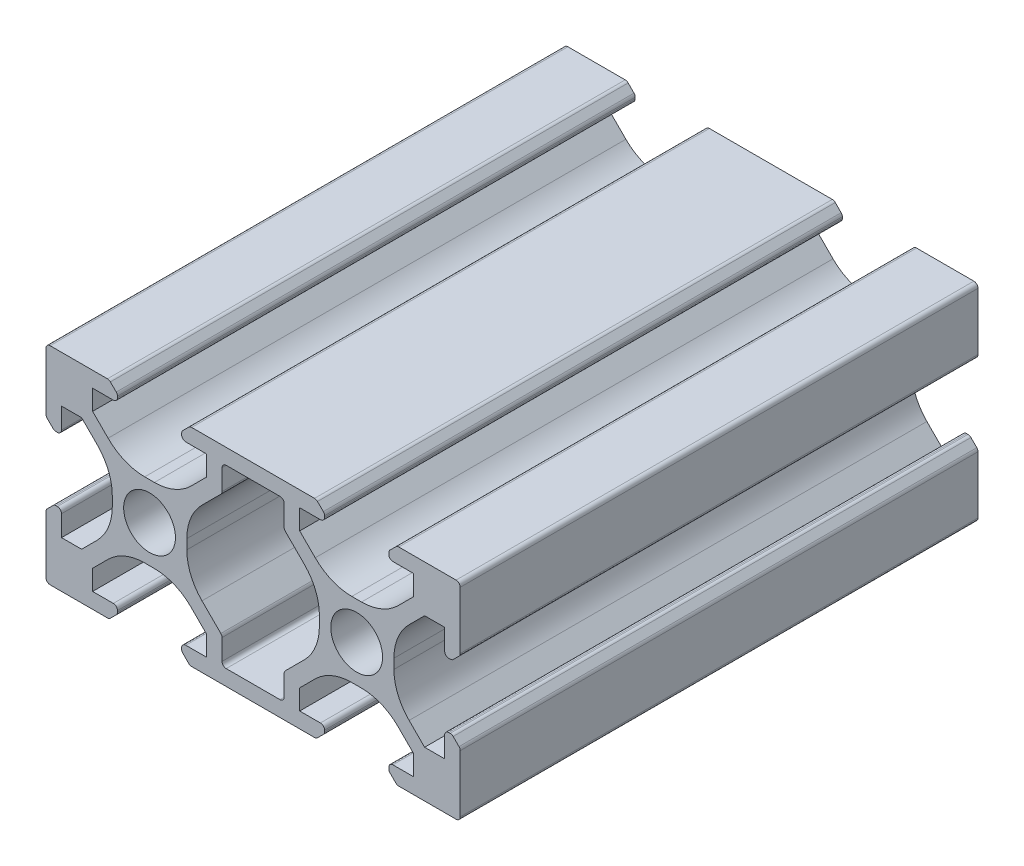
from build123d import *

# Parameters (mm, degrees)
RESSALTO_EXTRUS_O1_DEPTH    = 50
PADR_OCIRCULAR1_COUNT       = 4
PADR_O_LINEAR1_COUNT        = 2
PADR_O_LINEAR1_PITCH        = 20
PADR_O_LINEAR1_COPY_1_DEPTH = 50
PADR_O_LINEAR1_COPY_2_DEPTH = 50
PADR_O_LINEAR1_COPY_3_DEPTH = 50
CORTE_EXTRUS_O1_DEPTH       = 60.160797831
FILETE1_R                   = 0.4
FILETE2_R                   = 0.4


with BuildPart() as part:
    # Esboço1 → Ressalto-extrusão1 (new body)
    with BuildSketch(Plane.XY):
        with BuildLine():
            ThreePointArc((-9.317157288, 3.217157288), (-9.187387948, 3.130448187), (-9.034314575, 3.1))
            Line((-9.034314575, 3.1), (-8.9, 3.1))
            ThreePointArc((-8.9, 3.1), (-8.617157288, 3.217157288), (-8.5, 3.5))
            Line((-8.5, 3.5), (-8.5, 5.5))
            Line((-8.5, 5.5), (-6.560660172, 5.5))
            Line((-6.560660172, 5.5), (-5.064466094, 4.003805922))
            ThreePointArc((-5.064466094, 4.003805922), (-3.980602337, 2.381689178), (-3.6, 0.468272016))
            Line((-3.6, 0.468272016), (-3.6, 0))
            Line((-3.6, 0), (-2.5, 0))
            ThreePointArc((-2.5, 0), (-1.767766953, 1.767766953), (0, 2.5))
            Line((0, 2.5), (0, 3.6))
            Line((0, 3.6), (-0.468272016, 3.6))
            ThreePointArc((-0.468272016, 3.6), (-2.381689178, 3.980602337), (-4.003805922, 5.064466094))
            Line((-4.003805922, 5.064466094), (-5.5, 6.560660172))
            Line((-5.5, 6.560660172), (-5.5, 8.5))
            Line((-5.5, 8.5), (-3.5, 8.5))
            ThreePointArc((-3.5, 8.5), (-3.217157288, 8.617157288), (-3.1, 8.9))
            Line((-3.1, 8.9), (-3.1, 9.034314575))
            ThreePointArc((-3.1, 9.034314575), (-3.130448187, 9.187387948), (-3.217157288, 9.317157288))
            Line((-3.217157288, 9.317157288), (-3.782842712, 9.882842712))
            ThreePointArc((-3.782842712, 9.882842712), (-3.912612052, 9.969551813), (-4.065685425, 10))
            Line((-4.065685425, 10), (-10, 10))
            Line((-10, 10), (-10, 4.065685425))
            ThreePointArc((-10, 4.065685425), (-9.969551813, 3.912612052), (-9.882842712, 3.782842712))
            Line((-9.882842712, 3.782842712), (-9.317157288, 3.217157288))
        make_face()
    ressalto_extrus_o1 = extrude(amount=RESSALTO_EXTRUS_O1_DEPTH)

    # PadrãoCircular1: Ressalto-extrusão1 ×4 about axis
    padr_ocircular1_axis = Axis((0, 0, 0), (0, 0, 1))
    for i in range(1, PADR_OCIRCULAR1_COUNT):
        add(ressalto_extrus_o1.rotate(padr_ocircular1_axis, i * 360 / PADR_OCIRCULAR1_COUNT))

    # Padrão linear1: Ressalto-extrusão1 ×2
    with Locations(*[(i * PADR_O_LINEAR1_PITCH, 0, 0) for i in range(1, PADR_O_LINEAR1_COUNT)]):
        add(ressalto_extrus_o1)

    # Padrão linear1 copy 1 sketch → Padrão linear1 copy 1 (add)
    with BuildSketch(Plane(origin=(20, 0, 0), x_dir=(0, 1, 0), z_dir=(0, 0, 1))):
        with BuildLine():
            ThreePointArc((-9.317157288, 3.217157288), (-9.187387948, 3.130448187), (-9.034314575, 3.1))
            Line((-9.034314575, 3.1), (-8.9, 3.1))
            ThreePointArc((-8.9, 3.1), (-8.617157288, 3.217157288), (-8.5, 3.5))
            Line((-8.5, 3.5), (-8.5, 5.5))
            Line((-8.5, 5.5), (-6.560660172, 5.5))
            Line((-6.560660172, 5.5), (-5.064466094, 4.003805922))
            ThreePointArc((-5.064466094, 4.003805922), (-3.980602337, 2.381689178), (-3.6, 0.468272016))
            Line((-3.6, 0.468272016), (-3.6, 0))
            Line((-3.6, 0), (-2.5, 0))
            ThreePointArc((-2.5, 0), (-1.767766953, 1.767766953), (0, 2.5))
            Line((0, 2.5), (0, 3.6))
            Line((0, 3.6), (-0.468272016, 3.6))
            ThreePointArc((-0.468272016, 3.6), (-2.381689178, 3.980602337), (-4.003805922, 5.064466094))
            Line((-4.003805922, 5.064466094), (-5.5, 6.560660172))
            Line((-5.5, 6.560660172), (-5.5, 8.5))
            Line((-5.5, 8.5), (-3.5, 8.5))
            ThreePointArc((-3.5, 8.5), (-3.217157288, 8.617157288), (-3.1, 8.9))
            Line((-3.1, 8.9), (-3.1, 9.034314575))
            ThreePointArc((-3.1, 9.034314575), (-3.130448187, 9.187387948), (-3.217157288, 9.317157288))
            Line((-3.217157288, 9.317157288), (-3.782842712, 9.882842712))
            ThreePointArc((-3.782842712, 9.882842712), (-3.912612052, 9.969551813), (-4.065685425, 10))
            Line((-4.065685425, 10), (-10, 10))
            Line((-10, 10), (-10, 4.065685425))
            ThreePointArc((-10, 4.065685425), (-9.969551813, 3.912612052), (-9.882842712, 3.782842712))
            Line((-9.882842712, 3.782842712), (-9.317157288, 3.217157288))
        make_face()
    extrude(amount=PADR_O_LINEAR1_COPY_1_DEPTH)

    # Padrão linear1 copy 2 sketch → Padrão linear1 copy 2 (add)
    with BuildSketch(Plane(origin=(20, 0, 0), x_dir=(-1, 0, 0), z_dir=(0, 0, 1))):
        with BuildLine():
            ThreePointArc((-9.317157288, 3.217157288), (-9.187387948, 3.130448187), (-9.034314575, 3.1))
            Line((-9.034314575, 3.1), (-8.9, 3.1))
            ThreePointArc((-8.9, 3.1), (-8.617157288, 3.217157288), (-8.5, 3.5))
            Line((-8.5, 3.5), (-8.5, 5.5))
            Line((-8.5, 5.5), (-6.560660172, 5.5))
            Line((-6.560660172, 5.5), (-5.064466094, 4.003805922))
            ThreePointArc((-5.064466094, 4.003805922), (-3.980602337, 2.381689178), (-3.6, 0.468272016))
            Line((-3.6, 0.468272016), (-3.6, 0))
            Line((-3.6, 0), (-2.5, 0))
            ThreePointArc((-2.5, 0), (-1.767766953, 1.767766953), (0, 2.5))
            Line((0, 2.5), (0, 3.6))
            Line((0, 3.6), (-0.468272016, 3.6))
            ThreePointArc((-0.468272016, 3.6), (-2.381689178, 3.980602337), (-4.003805922, 5.064466094))
            Line((-4.003805922, 5.064466094), (-5.5, 6.560660172))
            Line((-5.5, 6.560660172), (-5.5, 8.5))
            Line((-5.5, 8.5), (-3.5, 8.5))
            ThreePointArc((-3.5, 8.5), (-3.217157288, 8.617157288), (-3.1, 8.9))
            Line((-3.1, 8.9), (-3.1, 9.034314575))
            ThreePointArc((-3.1, 9.034314575), (-3.130448187, 9.187387948), (-3.217157288, 9.317157288))
            Line((-3.217157288, 9.317157288), (-3.782842712, 9.882842712))
            ThreePointArc((-3.782842712, 9.882842712), (-3.912612052, 9.969551813), (-4.065685425, 10))
            Line((-4.065685425, 10), (-10, 10))
            Line((-10, 10), (-10, 4.065685425))
            ThreePointArc((-10, 4.065685425), (-9.969551813, 3.912612052), (-9.882842712, 3.782842712))
            Line((-9.882842712, 3.782842712), (-9.317157288, 3.217157288))
        make_face()
    extrude(amount=PADR_O_LINEAR1_COPY_2_DEPTH)

    # Padrão linear1 copy 3 sketch → Padrão linear1 copy 3 (add)
    with BuildSketch(Plane(origin=(20, 0, 0), x_dir=(0, -1, 0), z_dir=(0, 0, 1))):
        with BuildLine():
            ThreePointArc((-9.317157288, 3.217157288), (-9.187387948, 3.130448187), (-9.034314575, 3.1))
            Line((-9.034314575, 3.1), (-8.9, 3.1))
            ThreePointArc((-8.9, 3.1), (-8.617157288, 3.217157288), (-8.5, 3.5))
            Line((-8.5, 3.5), (-8.5, 5.5))
            Line((-8.5, 5.5), (-6.560660172, 5.5))
            Line((-6.560660172, 5.5), (-5.064466094, 4.003805922))
            ThreePointArc((-5.064466094, 4.003805922), (-3.980602337, 2.381689178), (-3.6, 0.468272016))
            Line((-3.6, 0.468272016), (-3.6, 0))
            Line((-3.6, 0), (-2.5, 0))
            ThreePointArc((-2.5, 0), (-1.767766953, 1.767766953), (0, 2.5))
            Line((0, 2.5), (0, 3.6))
            Line((0, 3.6), (-0.468272016, 3.6))
            ThreePointArc((-0.468272016, 3.6), (-2.381689178, 3.980602337), (-4.003805922, 5.064466094))
            Line((-4.003805922, 5.064466094), (-5.5, 6.560660172))
            Line((-5.5, 6.560660172), (-5.5, 8.5))
            Line((-5.5, 8.5), (-3.5, 8.5))
            ThreePointArc((-3.5, 8.5), (-3.217157288, 8.617157288), (-3.1, 8.9))
            Line((-3.1, 8.9), (-3.1, 9.034314575))
            ThreePointArc((-3.1, 9.034314575), (-3.130448187, 9.187387948), (-3.217157288, 9.317157288))
            Line((-3.217157288, 9.317157288), (-3.782842712, 9.882842712))
            ThreePointArc((-3.782842712, 9.882842712), (-3.912612052, 9.969551813), (-4.065685425, 10))
            Line((-4.065685425, 10), (-10, 10))
            Line((-10, 10), (-10, 4.065685425))
            ThreePointArc((-10, 4.065685425), (-9.969551813, 3.912612052), (-9.882842712, 3.782842712))
            Line((-9.882842712, 3.782842712), (-9.317157288, 3.217157288))
        make_face()
    extrude(amount=PADR_O_LINEAR1_COPY_3_DEPTH)

    # Esboço4 → Corte-extrusão1 (cut, through all)
    with BuildSketch(Plane(origin=(0, 0, 0), x_dir=(-1, 0, 0), z_dir=(0, 0, -1))):
        Polygon((-13.439339828, 5.5), (-13, 5.939339828), (-13, 8.5), (-7, 8.5), (-7, 5.939339828), (-6.560660172, 5.5), (-6.560660172, -5.5), (-7, -5.939339828), (-7, -8.5), (-13, -8.5), (-13, -5.939339828), (-13.439339828, -5.5), align=None)
    extrude(amount=-CORTE_EXTRUS_O1_DEPTH, mode=Mode.SUBTRACT)

    # Filete1
    filete1_edges = [part.edges().sort_by_distance(p)[0] for p in [
        (13, 5.939339828, 25),
        (13, 8.5, 25),
        (7, 8.5, 25),
        (7, 5.939339828, 25),
        (7, -5.939339828, 25),
        (7, -8.5, 25),
        (13, -8.5, 25),
        (13, -5.939339828, 25),
    ]]
    fillet(filete1_edges, radius=FILETE1_R)

    # Filete2
    filete2_edges = [part.edges().sort_by_distance(p)[0] for p in [
        (30, -10, 25),
        (30, 10, 25),
        (-10, 10, 25),
        (-10, -10, 25),
    ]]
    fillet(filete2_edges, radius=FILETE2_R)


solid = part.part
